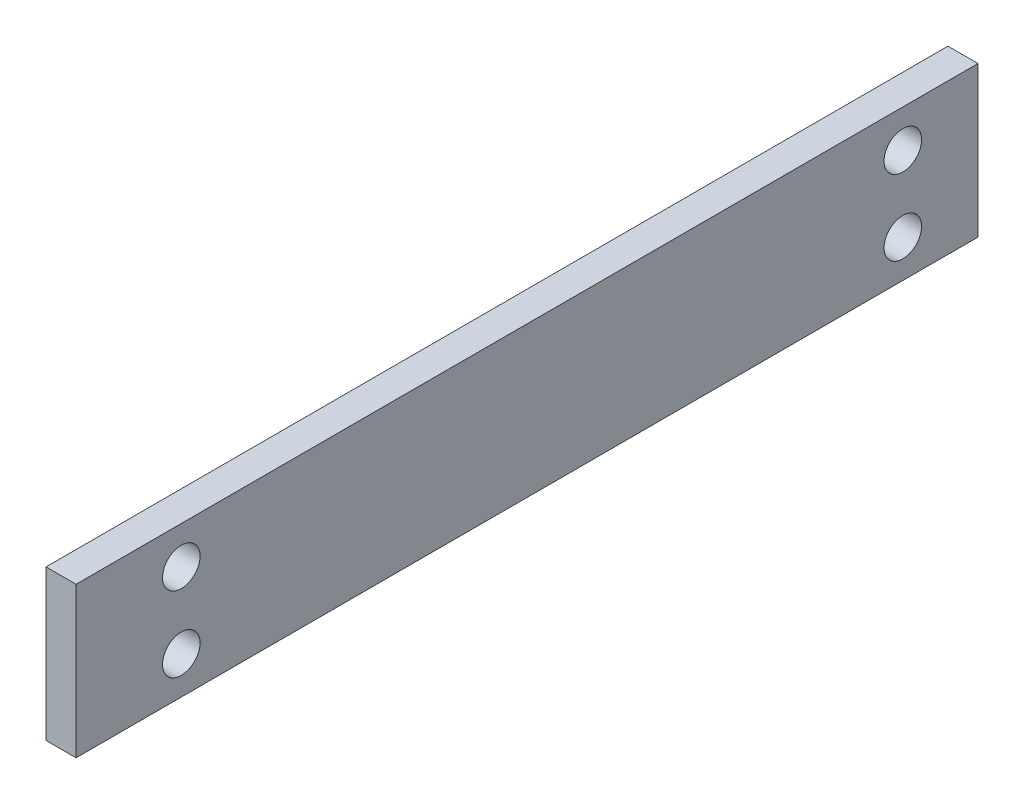
from build123d import *

# Parameters (mm, degrees)
SKETCH_1_W      = 120
SKETCH_1_H      = 20
SKETCH_1_R      = 2.5
EXTRUDE_1_DEPTH = 4


with BuildPart() as part:
    # Эскиз1 → Бобышка-Вытянуть1 (new body)
    with BuildSketch(Plane(origin=(0, 0, 0), x_dir=(0, 0, -1), z_dir=(1, 0, 0))):
        with Locations((60, 10)):
            Rectangle(SKETCH_1_W, SKETCH_1_H)
        with Locations((110, 15)):
            Circle(SKETCH_1_R, mode=Mode.SUBTRACT)
        with Locations((110, 5)):
            Circle(SKETCH_1_R, mode=Mode.SUBTRACT)
        with Locations((14, 15)):
            Circle(SKETCH_1_R, mode=Mode.SUBTRACT)
        with Locations((14, 5)):
            Circle(SKETCH_1_R, mode=Mode.SUBTRACT)
    extrude(amount=EXTRUDE_1_DEPTH)


solid = part.part
